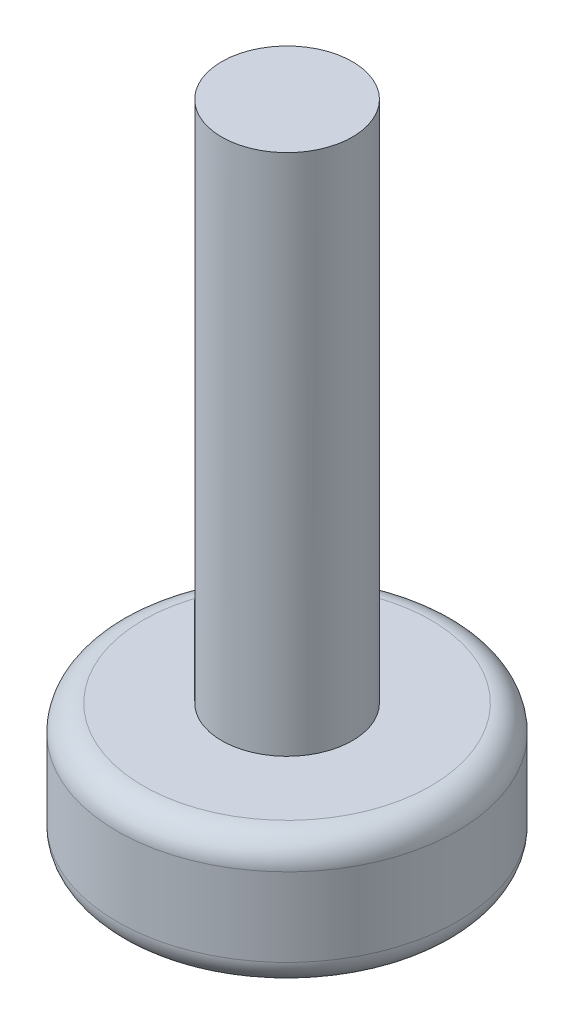
from build123d import *

# Parameters (mm, degrees)
SKETCH1_R           = 2.5
BOSS_EXTRUDE1_DEPTH = 20


with BuildPart() as part:
    # Sketch1 → Boss-Extrude1 (new body)
    with BuildSketch(Plane(origin=(0, 0, 0), x_dir=(1, 0, 0), z_dir=(0, 1, 0))):
        with Locations(Location((0, 0, 0), (0, 0, 270))):
            Circle(SKETCH1_R)
    extrude(amount=BOSS_EXTRUDE1_DEPTH)

    # Sketch2 → Revolve1 (revolve)
    with BuildSketch(Plane.XY):
        with BuildLine():
            Line((0, 0), (0, -5))
            Line((0, -5), (-5.5, -5))
            ThreePointArc((-5.5, -5), (-6.207106781, -4.707106781), (-6.5, -4))
            Line((-6.5, -4), (-6.5, -1))
            ThreePointArc((-6.5, -1), (-6.207106781, -0.292893219), (-5.5, 0))
            Line((-5.5, 0), (0, 0))
        make_face()
    revolve(axis=Axis((0, 0, 0), (0, -1, 0)))


solid = part.part
